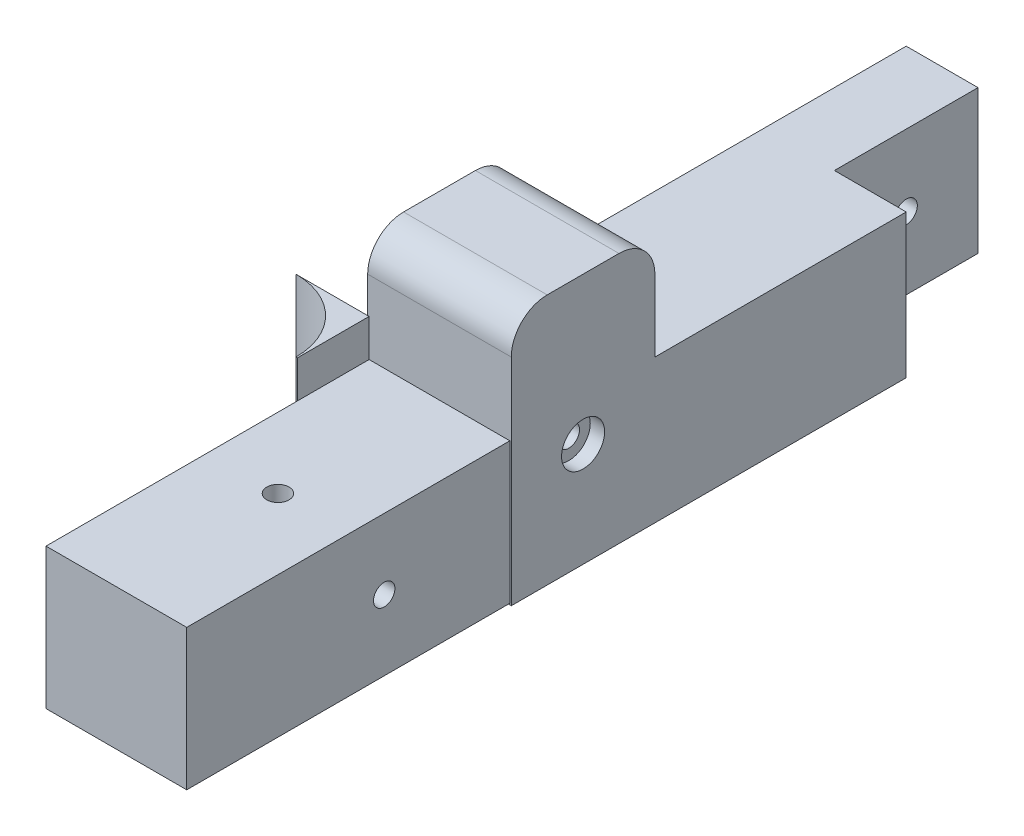
from build123d import *

# Parameters (mm, degrees)
SKETCH_1_W           = 20
SKETCH_1_H           = 20
EXTRUDE_1_DEPTH      = 120
SKETCH_2_W           = 10
SKETCH_2_H           = 20
CUT_EXTRUDE_1_DEPTH  = 120
CUT_EXTRUDE_2_DEPTH  = 120
SKETCH_4_R           = 3
CUT_EXTRUDE_3_DEPTH  = 2
SKETCH_6_R           = 1.49
CUT_EXTRUDE_4_DEPTH  = 20
CUT_EXTRUDE_5_DEPTH  = 20
SKETCH_8_W           = 19.6
SKETCH_8_H           = 0.2
SKETCH_8_W_2         = 0.2
SKETCH_8_H_2         = 19.6
CUT_EXTRUDE_6_DEPTH  = 45
EXTRUDE_2_DEPTH      = 24.8
EXTRUDE_START        = 5.2
EXTRUDE_3_DEPTH      = 5.2
SKETCH_12_W          = 20
SKETCH_12_H          = 20
EXTRUDE_4_DEPTH      = 15
CUT_EXTRUDE_7_DEPTH  = 15
SKETCH_14_R          = 2
CUT_EXTRUDE_8_DEPTH  = 70
SKETCH_15_R          = 1.5
CUT_EXTRUDE_9_DEPTH  = 5
SKETCH_16_R          = 3
CUT_EXTRUDE_10_DEPTH = 2
CUT_EXTRUDE_11_DEPTH = 20
SKETCH_18_W          = 0.2
SKETCH_18_H          = 25.5
CUT_EXTRUDE_12_DEPTH = 15


with BuildPart() as part:
    # 草图1 → 凸台-拉伸1 (new body)
    with BuildSketch(Plane.XY):
        with Locations((10, 10)):
            Rectangle(SKETCH_1_W, SKETCH_1_H)
    extrude(amount=EXTRUDE_1_DEPTH)

    # 草图2 → 切除-拉伸1 (cut)
    with BuildSketch(Plane(origin=(0, 20, 0), x_dir=(1, 0, 0), z_dir=(0, 1, 0))):
        with Locations((15, -10)):
            Rectangle(SKETCH_2_W, SKETCH_2_H)
    extrude(amount=-CUT_EXTRUDE_1_DEPTH, mode=Mode.SUBTRACT)

    # 草图3 → 切除-拉伸2 (cut)
    with BuildSketch(Plane(origin=(10, 0, 0), x_dir=(0, 0, -1), z_dir=(1, 0, 0))):
        with BuildLine():
            ThreePointArc((-8.45, 10), (-9.40684068, 11.432013275), (-11.096015511, 11.096015511))
            Line((-11.096015511, 11.096015511), (-8.903984489, 8.903984489))
            ThreePointArc((-8.903984489, 8.903984489), (-8.567986725, 9.40684068), (-8.45, 10))
        make_face()
        with BuildLine():
            Line((-8.903984489, 8.903984489), (-11.096015511, 11.096015511))
            ThreePointArc((-11.096015511, 11.096015511), (-11.096015511, 8.903984489), (-8.903984489, 8.903984489))
        make_face()
    extrude(amount=-CUT_EXTRUDE_2_DEPTH, mode=Mode.SUBTRACT)

    # 草图4 → 切除-拉伸3 (cut)
    with BuildSketch(Plane.ZY):
        with Locations((10, 10)):
            Circle(SKETCH_4_R)
    extrude(amount=-CUT_EXTRUDE_3_DEPTH, mode=Mode.SUBTRACT)

    # 草图6 → 切除-拉伸4 (cut)
    with BuildSketch(Plane.ZY):
        with Locations((92.5, 10)):
            Circle(SKETCH_6_R)
    extrude(amount=-CUT_EXTRUDE_4_DEPTH, mode=Mode.SUBTRACT)

    # 草图7 → 切除-拉伸5 (cut)
    with BuildSketch(Plane.XZ):
        with BuildLine():
            ThreePointArc((11.55, 97.5), (10.844615988, 98.799662969), (9.370485378, 98.9164079))
            Line((9.370485378, 98.9164079), (10.629514622, 96.0835921))
            ThreePointArc((10.629514622, 96.0835921), (11.299662969, 96.655384012), (11.55, 97.5))
        make_face()
        with BuildLine():
            Line((10.629514622, 96.0835921), (9.370485378, 98.9164079))
            ThreePointArc((9.370485378, 98.9164079), (8.5835921, 96.870485378), (10.629514622, 96.0835921))
        make_face()
    extrude(amount=-CUT_EXTRUDE_5_DEPTH, mode=Mode.SUBTRACT)

    # 草图8 → 切除-拉伸6 (cut)
    with BuildSketch(Plane.XY.offset(120)):
        with Locations((10, 19.9)):
            Rectangle(SKETCH_8_W, SKETCH_8_H)
        with Locations((0.1, 19.9)):
            Rectangle(SKETCH_8_W_2, SKETCH_8_H)
        with Locations((0.1, 10)):
            Rectangle(SKETCH_8_W_2, SKETCH_8_H_2)
        with Locations((19.9, 10)):
            Rectangle(SKETCH_8_W_2, SKETCH_8_H_2)
        with Locations((19.9, 0.1)):
            Rectangle(SKETCH_8_W_2, SKETCH_8_H)
        with Locations((10, 0.1)):
            Rectangle(SKETCH_8_W, SKETCH_8_H)
        with Locations((0.1, 0.1)):
            Rectangle(SKETCH_8_W_2, SKETCH_8_H)
        with Locations((19.9, 19.9)):
            Rectangle(SKETCH_8_W_2, SKETCH_8_H)
    extrude(amount=-CUT_EXTRUDE_6_DEPTH, mode=Mode.SUBTRACT)

    # 草图9 → 凸台-拉伸2 (add)
    with BuildSketch(Plane(origin=(0, 19.8, 0), x_dir=(1, 0, 0), z_dir=(0, 1, 0))):
        with BuildLine():
            Line((0, -75), (-10, -75))
            ThreePointArc((-10, -75), (-2.928932188, -77.928932188), (0, -85))
            Line((0, -85), (0.2, -85))
            Line((0.2, -85), (0.2, -75))
            Line((0.2, -75), (0, -75))
        make_face()
    extrude(amount=-EXTRUDE_2_DEPTH)

    # 草图10 → 凸台-拉伸3 (add)
    with BuildSketch(Plane(origin=(0, 19.8, 0), x_dir=(1, 0, 0), z_dir=(0, 1, 0)).offset(EXTRUDE_START)):
        with BuildLine():
            Line((-10, -75), (0, -75))
            Line((0, -75), (0.2, -75))
            Line((0.2, -75), (0.2, -85))
            Line((0.2, -85), (0, -85))
            ThreePointArc((0, -85), (-2.928932188, -77.928932188), (-10, -75))
        make_face()
    extrude(amount=-EXTRUDE_3_DEPTH)

    # 草图12 → 凸台-拉伸4 (add)
    with BuildSketch(Plane(origin=(0, 20, 0), x_dir=(1, 0, 0), z_dir=(0, 1, 0))):
        with Locations((10, -65)):
            Rectangle(SKETCH_12_W, SKETCH_12_H)
    extrude(amount=EXTRUDE_4_DEPTH)

    # 草图13 → 切除-拉伸7 (cut)
    with BuildSketch(Plane.ZY):
        Polygon((65, 20), (60, 20), (60, 4), (70, 4), (70, 20), align=None)
        Polygon((60, 29.5), (60, 20), (65, 20), (65, 25), (65, 29.5), align=None)
        Polygon((65, 25), (65, 20), (70, 20), (70, 29.5), (65, 29.5), align=None)
    extrude(amount=-CUT_EXTRUDE_7_DEPTH, mode=Mode.SUBTRACT)

    # 草图14 → 切除-拉伸8 (cut)
    with BuildSketch(Plane(origin=(0, 0, 0), x_dir=(-1, 0, 0), z_dir=(0, 0, -1))):
        with Locations((-5, 6)):
            Circle(SKETCH_14_R)
    extrude(amount=-CUT_EXTRUDE_8_DEPTH, mode=Mode.SUBTRACT)

    # 草图15 → 切除-拉伸9 (cut)
    with BuildSketch(Plane.ZY.offset(-15)):
        with Locations((65, 14.5)):
            Circle(SKETCH_15_R)
    extrude(amount=-CUT_EXTRUDE_9_DEPTH, mode=Mode.SUBTRACT)

    # 草图16 → 切除-拉伸10 (cut)
    with BuildSketch(Plane(origin=(20, 0, 0), x_dir=(0, 0, -1), z_dir=(1, 0, 0))):
        with Locations((-65, 14.5)):
            Circle(SKETCH_16_R)
    extrude(amount=-CUT_EXTRUDE_10_DEPTH, mode=Mode.SUBTRACT)

    # 草图17 → 切除-拉伸11 (cut)
    with BuildSketch(Plane.ZY):
        with BuildLine():
            Line((60, 35), (55, 35))
            Line((55, 35), (55, 30))
            ThreePointArc((55, 30), (56.464466094, 33.535533906), (60, 35))
        make_face()
        with BuildLine():
            Line((75, 35), (70, 35))
            ThreePointArc((70, 35), (73.535533906, 33.535533906), (75, 30))
            Line((75, 30), (75, 35))
        make_face()
    extrude(amount=-CUT_EXTRUDE_11_DEPTH, mode=Mode.SUBTRACT)

    # 草图18 → 切除-拉伸12 (cut)
    with BuildSketch(Plane.ZY):
        with Locations((59.9, 16.75)):
            Rectangle(SKETCH_18_W, SKETCH_18_H)
        Polygon((70, 29.5), (70.2, 29.5), (70.2, 29.7), (59.8, 29.7), (59.8, 29.5), (60, 29.5), align=None)
        with Locations((70.1, 16.75)):
            Rectangle(SKETCH_18_W, SKETCH_18_H)
    extrude(amount=-CUT_EXTRUDE_12_DEPTH, mode=Mode.SUBTRACT)


solid = part.part
